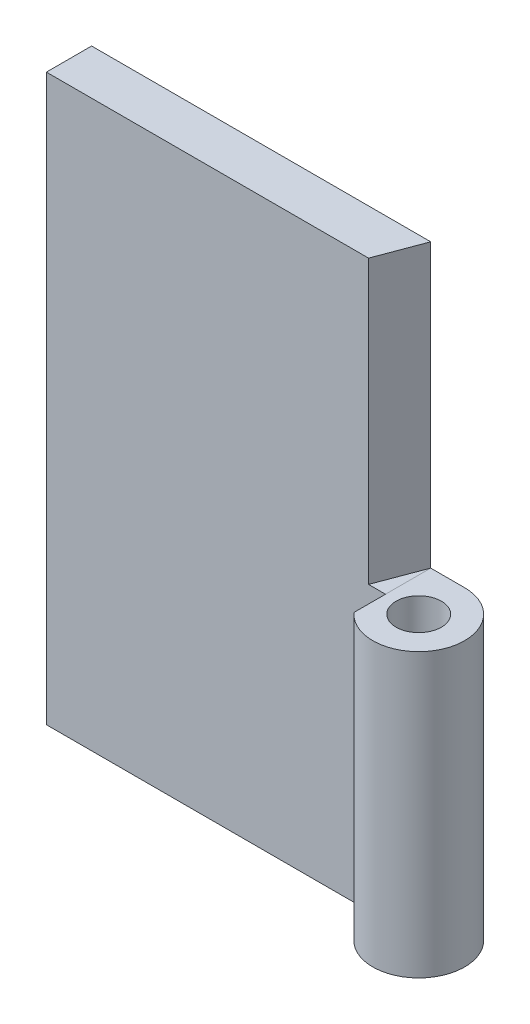
from build123d import *

# Parameters (mm, degrees)
SKETCH1_W           = 15
SKETCH1_H           = 25
BOSS_EXTRUDE1_DEPTH = 2
BOSS_EXTRUDE3_DEPTH = 12.5
SKETCH5_R           = 1
CUT_EXTRUDE2_DEPTH  = 32.382981587
CUT_EXTRUDE4_DEPTH  = 12.5


with BuildPart() as part:
    # Sketch1 → Boss-Extrude1 (new body)
    with BuildSketch(Plane.XY):
        with Locations((7.5, -12.5)):
            Rectangle(SKETCH1_W, SKETCH1_H)
    extrude(amount=BOSS_EXTRUDE1_DEPTH)

    # Sketch7 → Cut-Extrude4 (cut)
    with BuildSketch(Plane(origin=(0, 0, 0), x_dir=(1, 0, 0), z_dir=(0, 1, 0))):
        Polygon((15, 0), (14.25, -2), (15, -2), align=None)
    extrude(amount=-CUT_EXTRUDE4_DEPTH, mode=Mode.SUBTRACT)


with BuildPart() as body_2:
    # Sketch4 → Boss-Extrude3 (new body)
    with BuildSketch(Plane.XZ.offset(25)):
        with BuildLine():
            Line((15, 0), (16.5, 0))
            ThreePointArc((16.5, 0), (18.358090418, 2.850628125), (15, 3.4))
            Line((15, 3.4), (15, 0))
        make_face()
    extrude(amount=-BOSS_EXTRUDE3_DEPTH)

    # Sketch5 → Cut-Extrude2 (cut, through all)
    with BuildSketch(Plane.XZ.offset(25)):
        with Locations(Location((16.5, 2.030882353, 0), (0, 0, 270))):
            Circle(SKETCH5_R)
    extrude(amount=-CUT_EXTRUDE2_DEPTH, mode=Mode.SUBTRACT)


solid = Compound([part.part, body_2.part])
